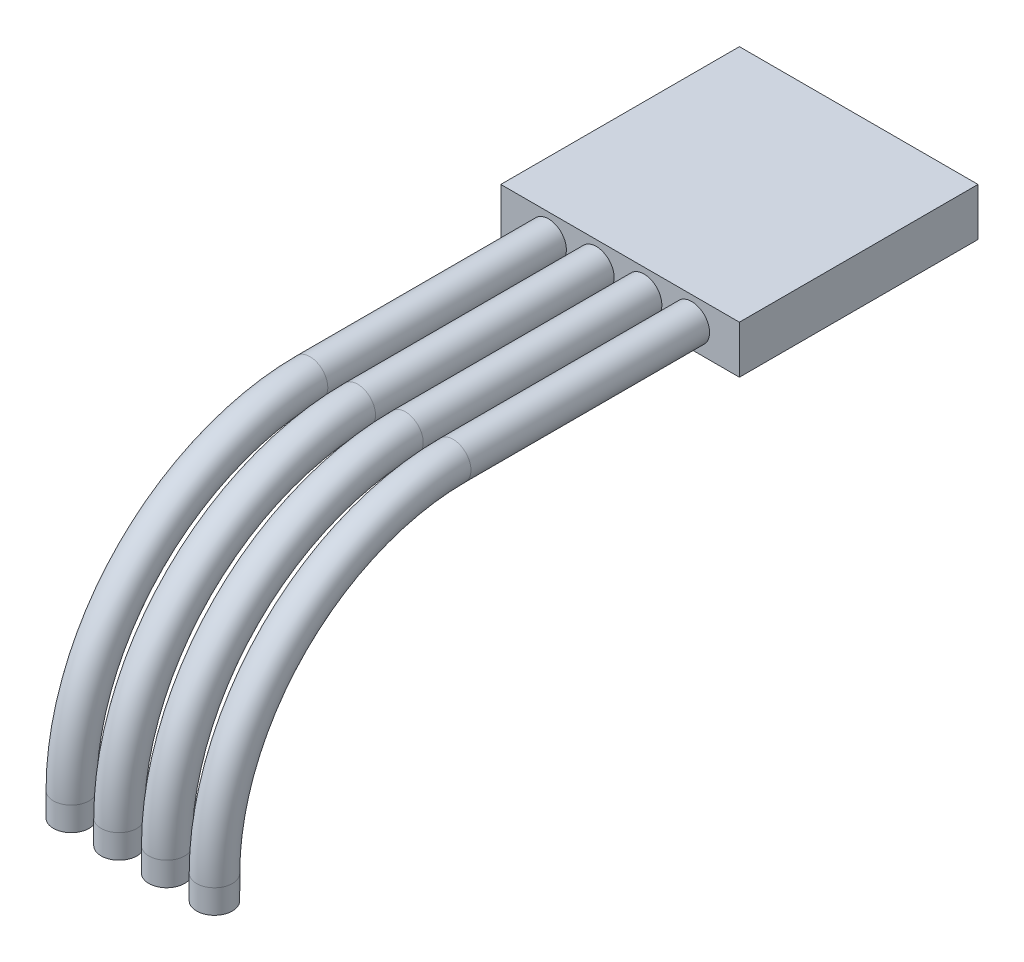
from build123d import *

# Parameters (mm, degrees)
SKIZZE1_W                       = 10
SKIZZE1_H                       = 2
AUFSATZ_LINEAR_AUSTRAGEN1_DEPTH = 10
SKIZZE2_R                       = 0.75
AUFSATZ_LINEAR_AUSTRAGEN2_DEPTH = 10
SKIZZE4_R                       = 0.75
LINEARES_MUSTER1_COUNT          = 4
LINEARES_MUSTER1_PITCH          = 2


with BuildPart() as part:
    # Skizze1 → Aufsatz-Linear austragen1 (new body)
    with BuildSketch(Plane.XY):
        Rectangle(SKIZZE1_W, SKIZZE1_H)
    extrude(amount=AUFSATZ_LINEAR_AUSTRAGEN1_DEPTH)

    # Skizze2 → Aufsatz-Linear austragen2 (add)
    with BuildSketch(Plane.XY.offset(10)):
        with Locations(Location((-1, 0, 0), (0, 0, 180))):
            Circle(SKIZZE2_R)
        with Locations(Location((-3, 0, 0), (0, 0, 180))):
            Circle(SKIZZE2_R)
        with Locations(Location((1, 0, 0), (0, 0, 180))):
            Circle(SKIZZE2_R)
        with Locations(Location((3, 0, 0), (0, 0, 180))):
            Circle(SKIZZE2_R)
    extrude(amount=AUFSATZ_LINEAR_AUSTRAGEN2_DEPTH)

    # Austragung1: sweep along a path in Skizze3
    with BuildLine(Plane(origin=(-3, 0, 0), x_dir=(0, 0, -1), z_dir=(1, 0, 0))) as austragung1_path:
        Line((-30, -11), (-30, -10))
        ThreePointArc((-30, -10), (-27.071067812, -2.928932188), (-20, 0))
    # Skizze4 → Austragung1 (sweep)
    with BuildSketch(Plane.XY.offset(20)):
        with Locations((-3, 0)):
            Circle(SKIZZE4_R)
    austragung1 = sweep(path=austragung1_path.line)

    # Lineares Muster1: Austragung1 ×4
    with Locations(*[(i * LINEARES_MUSTER1_PITCH, 0, 0) for i in range(1, LINEARES_MUSTER1_COUNT)]):
        add(austragung1)


solid = part.part
